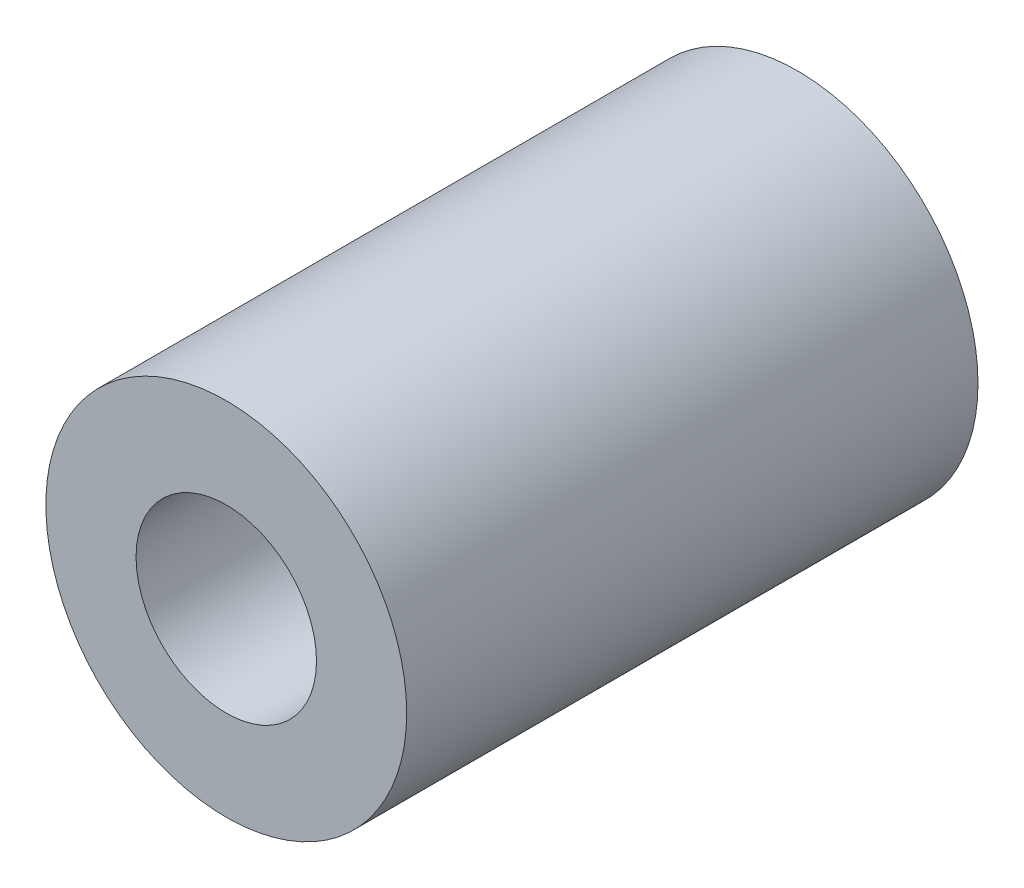
from build123d import *

# Parameters (mm, degrees)
SKETCH2_R           = 6
SKETCH2_R_2         = 3
BOSS_EXTRUDE1_DEPTH = 9.5


with BuildPart() as part:
    # Sketch2 → Boss-Extrude1 (new, symmetric)
    with BuildSketch(Plane.XY):
        Circle(SKETCH2_R)
        Circle(SKETCH2_R_2, mode=Mode.SUBTRACT)
    extrude(amount=BOSS_EXTRUDE1_DEPTH, both=True)


solid = part.part
